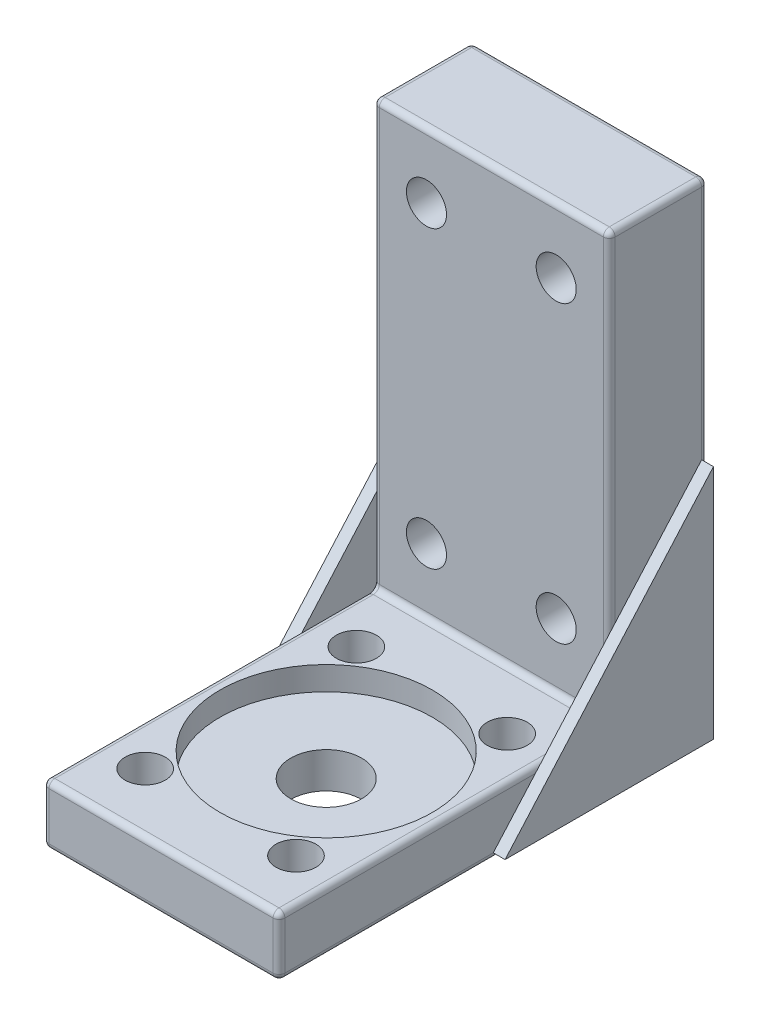
from build123d import *

# Parameters (mm, degrees)
SKETCH1_W           = 20
SKETCH1_H           = 28
BOSS_EXTRUDE1_DEPTH = 5.04
SKETCH3_R           = 9
CUT_EXTRUDE1_DEPTH  = 2
SKETCH4_R           = 3
CUT_EXTRUDE2_DEPTH  = 35.543329313
SKETCH7_R           = 1.7
CUT_EXTRUDE3_DEPTH  = 35.776451803
BOSS_EXTRUDE2_DEPTH = 8.331
SKETCH9_R           = 1.7
CUT_EXTRUDE4_DEPTH  = 54.556340428
FILLET2_R           = 0.5
BOSS_EXTRUDE3_DEPTH = 1
BOSS_EXTRUDE4_DEPTH = 1


with BuildPart() as part:
    # Sketch1 → Boss-Extrude1 (new body)
    with BuildSketch(Plane(origin=(0, 0, 0), x_dir=(1, 0, 0), z_dir=(0, 1, 0))):
        with Locations((10, 14)):
            Rectangle(SKETCH1_W, SKETCH1_H)
    extrude(amount=BOSS_EXTRUDE1_DEPTH)

    # Sketch3 → Cut-Extrude1 (cut)
    with BuildSketch(Plane(origin=(0, 5.04, 0), x_dir=(1, 0, 0), z_dir=(0, 1, 0))):
        with Locations((10, 14)):
            Circle(SKETCH3_R)
    extrude(amount=-CUT_EXTRUDE1_DEPTH, mode=Mode.SUBTRACT)

    # Sketch4 → Cut-Extrude2 (cut, through all)
    with BuildSketch(Plane(origin=(0, 3.04, 0), x_dir=(1, 0, 0), z_dir=(0, 1, 0))):
        with Locations((10, 14)):
            Circle(SKETCH4_R)
    extrude(amount=-CUT_EXTRUDE2_DEPTH, mode=Mode.SUBTRACT)

    # Sketch7 → Cut-Extrude3 (cut, through all)
    with BuildSketch(Plane(origin=(0, 5.04, 0), x_dir=(1, 0, 0), z_dir=(0, 1, 0))):
        with Locations((3.607579394, 22.951924866)):
            Circle(SKETCH7_R)
        with Locations((16.392420606, 22.951924866)):
            Circle(SKETCH7_R)
        with Locations((16.392420606, 5.048075134)):
            Circle(SKETCH7_R)
        with Locations((3.607579394, 5.048075134)):
            Circle(SKETCH7_R)
    extrude(amount=-CUT_EXTRUDE3_DEPTH, mode=Mode.SUBTRACT)

    # Sketch8 → Boss-Extrude2 (add)
    with BuildSketch(Plane(origin=(0, 0, -28), x_dir=(-1, 0, 0), z_dir=(0, 0, -1))):
        Polygon((-20, 5.04), (-20, 41.04), (0, 41.04), (0, 5.04), (0, 0), (-20, 0), align=None)
    extrude(amount=BOSS_EXTRUDE2_DEPTH)

    # Sketch9 → Cut-Extrude4 (cut, through all)
    with BuildSketch(Plane.XY.offset(-28)):
        with Locations((4.5, 10.54)):
            Circle(SKETCH9_R)
        with Locations((15.5, 10.54)):
            Circle(SKETCH9_R)
        with Locations((15.5, 35.54)):
            Circle(SKETCH9_R)
        with Locations((4.5, 35.54)):
            Circle(SKETCH9_R)
    extrude(amount=-CUT_EXTRUDE4_DEPTH, mode=Mode.SUBTRACT)

    # Fillet2
    fillet2_edges = [part.edges().sort_by_distance(p)[0] for p in [
        (10, 5.04, -28),
        (0, 41.04, -32.1655),
        (10, 41.04, -36.331),
        (20, 41.04, -32.1655),
        (10, 41.04, -28),
        (20, 23.04, -28),
        (20, 20.52, -36.331),
        (0, 23.04, -28),
        (10, 0, -36.331),
        (0, 20.52, -36.331),
        (0, 0, -18.1655),
        (20, 0, -18.1655),
        (10, 0, 0),
        (20, 2.52, 0),
        (0, 2.52, 0),
        (0, 5.04, -14),
        (10, 5.04, 0),
        (20, 5.04, -14),
    ]]
    fillet(fillet2_edges, radius=FILLET2_R)

    # Sketch10 → Boss-Extrude3 (add)
    with BuildSketch(Plane(origin=(20, 0, 0), x_dir=(0, 0, -1), z_dir=(1, 0, 0))):
        Polygon((18.1655, 0.5), (35.831, 20.52), (35.831, 0.5), align=None)
    extrude(amount=BOSS_EXTRUDE3_DEPTH)

    # Sketch11 → Boss-Extrude4 (add)
    with BuildSketch(Plane.ZY):
        Polygon((-18.1655, 0.5), (-35.831, 20.52), (-35.831, 0.5), align=None)
    extrude(amount=BOSS_EXTRUDE4_DEPTH)


solid = part.part
